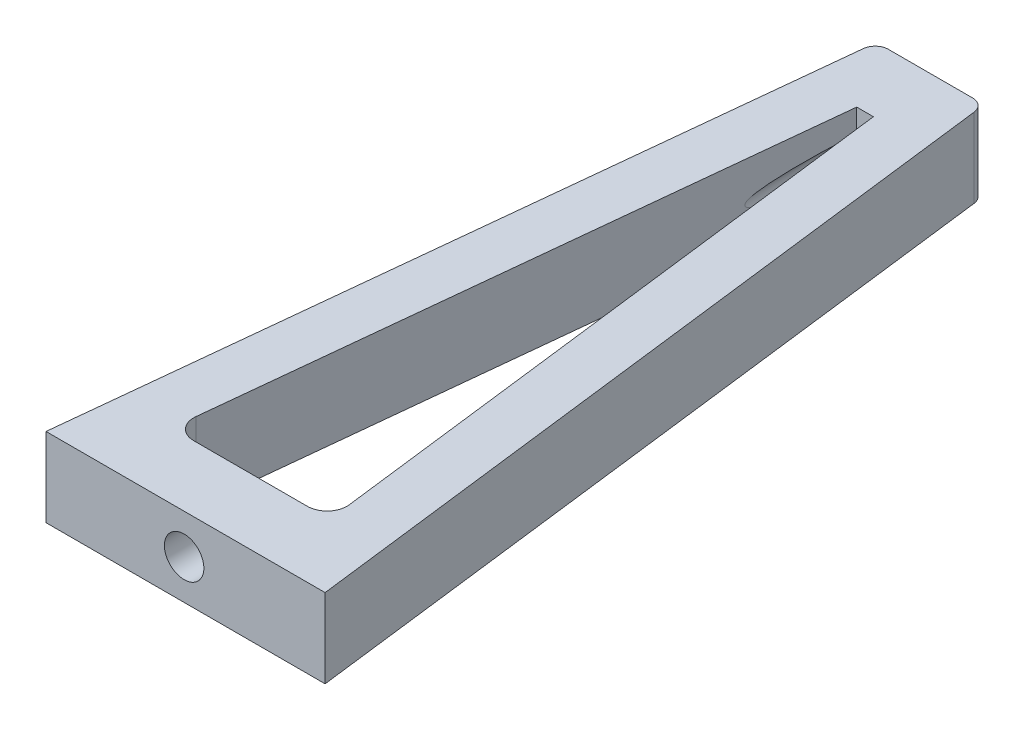
from build123d import *

# Parameters (mm, degrees)
BOSS_EXTRUDE1_DEPTH = 6
SKETCH3_R           = 1.4
CUT_EXTRUDE1_DEPTH  = 20
SKETCH4_R           = 1.5
CUT_EXTRUDE2_DEPTH  = 200


with BuildPart() as part:
    # Sketch1 → Boss-Extrude1 (new body)
    with BuildSketch(Plane(origin=(0, 0, 0), x_dir=(1, 0, 0), z_dir=(0, 1, 0))):
        with BuildLine():
            Line((5.807869676, 47.103606084), (12.202893506, 47.103606084))
            ThreePointArc((12.202893506, 47.103606084), (12.865186965, 46.85285062), (13.195333016, 46.226340832))
            Line((13.195333016, 46.226340832), (20.148830597, -10))
            Line((20.148830597, -10), (-1.041666667, -10))
            Line((-1.041666667, -10), (4.813251268, 46.207212169))
            ThreePointArc((4.813251268, 46.207212169), (5.13839454, 46.846440549), (5.807869676, 47.103606084))
        make_face()
        with BuildLine():
            Line((9.674718252, 42.103606084), (15.291737007, -3.315897879))
            ThreePointArc((15.291737007, -3.315897879), (14.926944544, -4.493440189), (13.803077741, -5))
            Line((13.803077741, -5), (5.165175568, -5))
            ThreePointArc((5.165175568, -5), (4.050923871, -4.504212704), (3.673247955, -3.344590874))
            Line((3.673247955, -3.344590874), (8.407435138, 42.103606084))
            Line((8.407435138, 42.103606084), (9.674718252, 42.103606084))
        make_face(mode=Mode.SUBTRACT)
    extrude(amount=BOSS_EXTRUDE1_DEPTH)

    # Sketch3 → Cut-Extrude1 (cut)
    with BuildSketch(Plane(origin=(0, 0, -47.103606084), x_dir=(-1, 0, 0), z_dir=(0, 0, -1))):
        with Locations((-9.005381591, 3)):
            Circle(SKETCH3_R)
    extrude(amount=-CUT_EXTRUDE1_DEPTH, mode=Mode.SUBTRACT)

    # Sketch4 → Cut-Extrude2 (cut)
    with BuildSketch(Plane.XY):
        with Locations(Location((9.445211312, 3, 0), (0, 0, 180))):
            Circle(SKETCH4_R)
    extrude(amount=CUT_EXTRUDE2_DEPTH, mode=Mode.SUBTRACT)


solid = part.part
